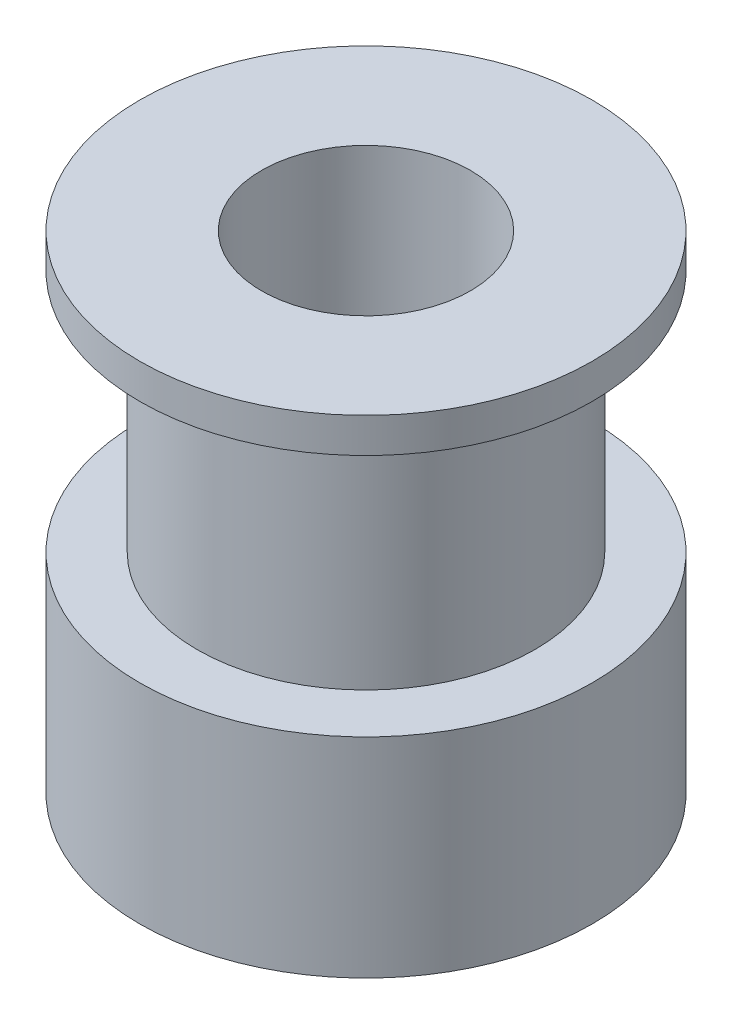
from build123d import *


with BuildPart() as part:
    # Sketch1 → Revolve1 (revolve)
    with BuildSketch(Plane.XY, mode=Mode.PRIVATE) as revolve1_sk:
        Polygon((6.5, 0), (6.5, 6), (4.85, 6), (4.85, 13), (6.5, 13), (6.5, 14), (3, 14), (3, 0), align=None)
    revolve(revolve1_sk.sketch.rotate(Axis((0, 0, 0), (0, 1, 0)), 90), axis=Axis((0, 0, 0), (0, 1, 0)))


solid = part.part
